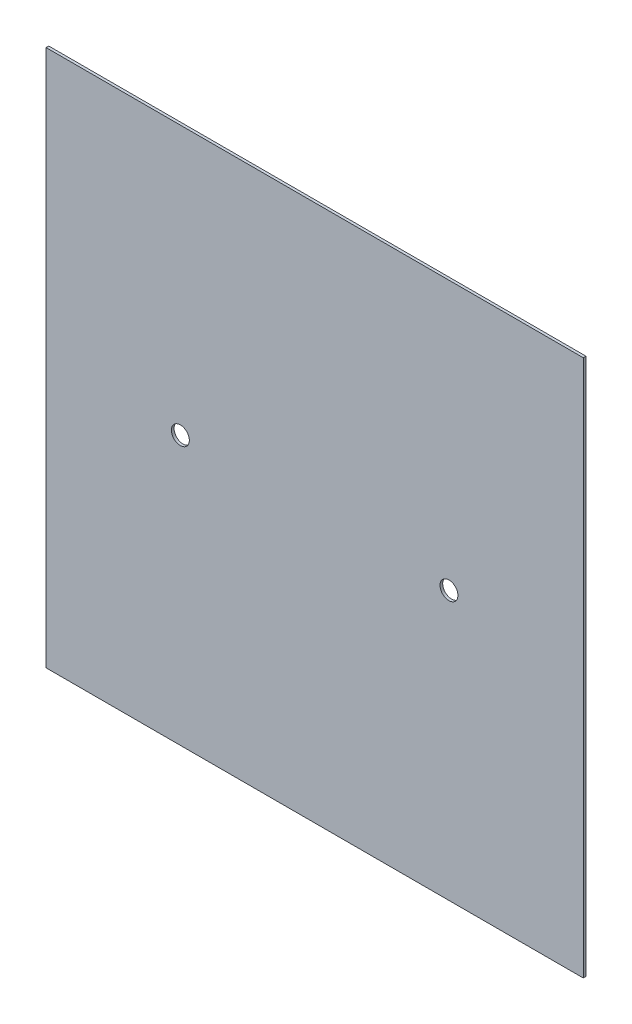
from build123d import *

# Parameters (mm, degrees)
SKETCH2_W           = 300
SKETCH2_H           = 300
SKETCH2_R           = 5
BOSS_EXTRUDE1_DEPTH = 1.5


with BuildPart() as part:
    # Sketch2 → Boss-Extrude1 (new body)
    with BuildSketch(Plane.XY):
        Rectangle(SKETCH2_W, SKETCH2_H)
        with Locations((-75, 0)):
            Circle(SKETCH2_R, mode=Mode.SUBTRACT)
        with Locations((75, 0)):
            Circle(SKETCH2_R, mode=Mode.SUBTRACT)
    extrude(amount=BOSS_EXTRUDE1_DEPTH)


solid = part.part
